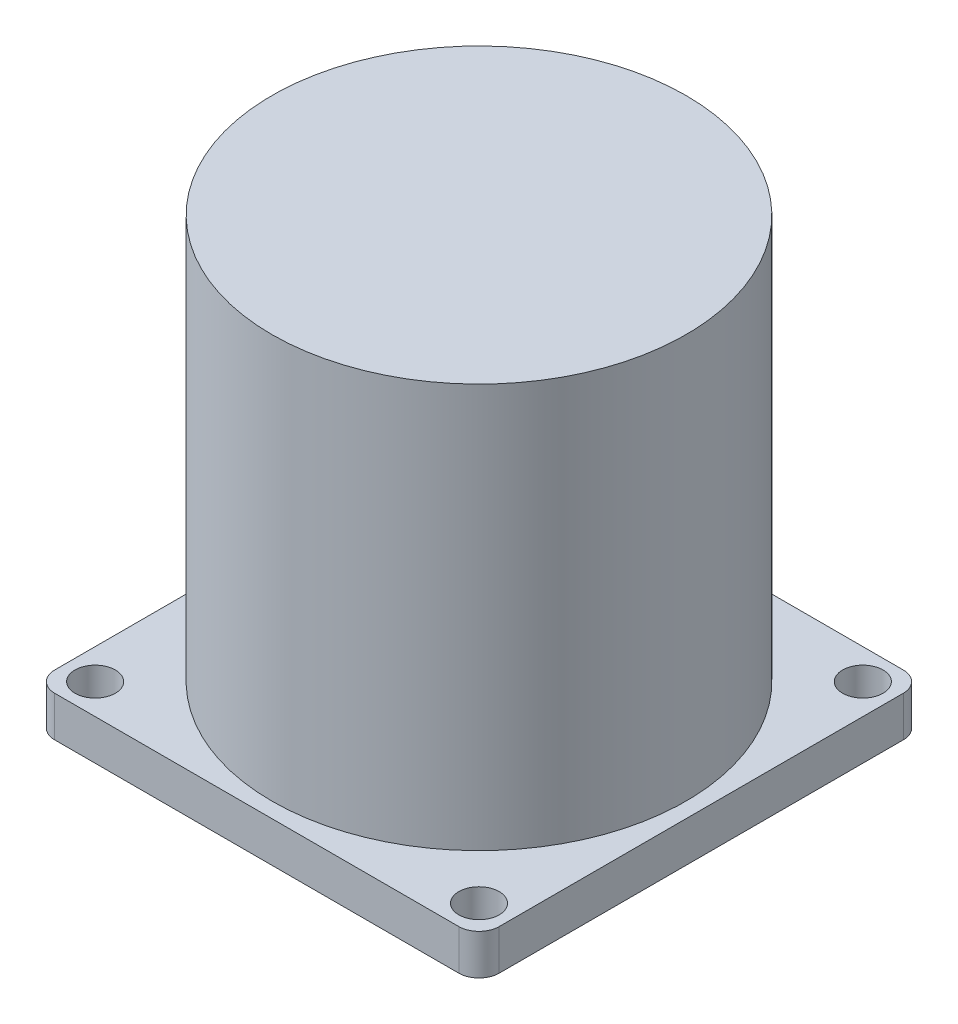
from build123d import *

# Parameters (mm, degrees)
SKETCH1_W           = 220
SKETCH1_H           = 220
SKETCH1_R           = 10
BOSS_EXTRUDE2_DEPTH = 20
FILLET5_R           = 10
SKETCH6_R           = 102.5
BOSS_EXTRUDE3_DEPTH = 200


with BuildPart() as part:
    # Sketch1 → Boss-Extrude2 (new body)
    with BuildSketch(Plane(origin=(0, 0, 0), x_dir=(1, 0, 0), z_dir=(0, 1, 0))):
        Rectangle(SKETCH1_W, SKETCH1_H)
        with Locations(Location((-95, 95, 0), (0, 0, 270))):
            Circle(SKETCH1_R, mode=Mode.SUBTRACT)
        with Locations(Location((95, 95, 0), (0, 0, 270))):
            Circle(SKETCH1_R, mode=Mode.SUBTRACT)
        with Locations(Location((95, -95, 0), (0, 0, 270))):
            Circle(SKETCH1_R, mode=Mode.SUBTRACT)
        with Locations(Location((-95, -95, 0), (0, 0, 270))):
            Circle(SKETCH1_R, mode=Mode.SUBTRACT)
    extrude(amount=BOSS_EXTRUDE2_DEPTH)

    # Fillet5
    fillet5_edges = [part.edges().sort_by_distance(p)[0] for p in [
        (110, 10, 110),
        (-110, 10, 110),
        (-110, 10, -110),
        (110, 10, -110),
    ]]
    fillet(fillet5_edges, radius=FILLET5_R)

    # Sketch6 → Boss-Extrude3 (add)
    with BuildSketch(Plane(origin=(0, 20, 0), x_dir=(1, 0, 0), z_dir=(0, 1, 0))):
        with Locations(Location((0, 0, 0), (0, 0, 270))):
            Circle(SKETCH6_R)
    extrude(amount=BOSS_EXTRUDE3_DEPTH)


solid = part.part
